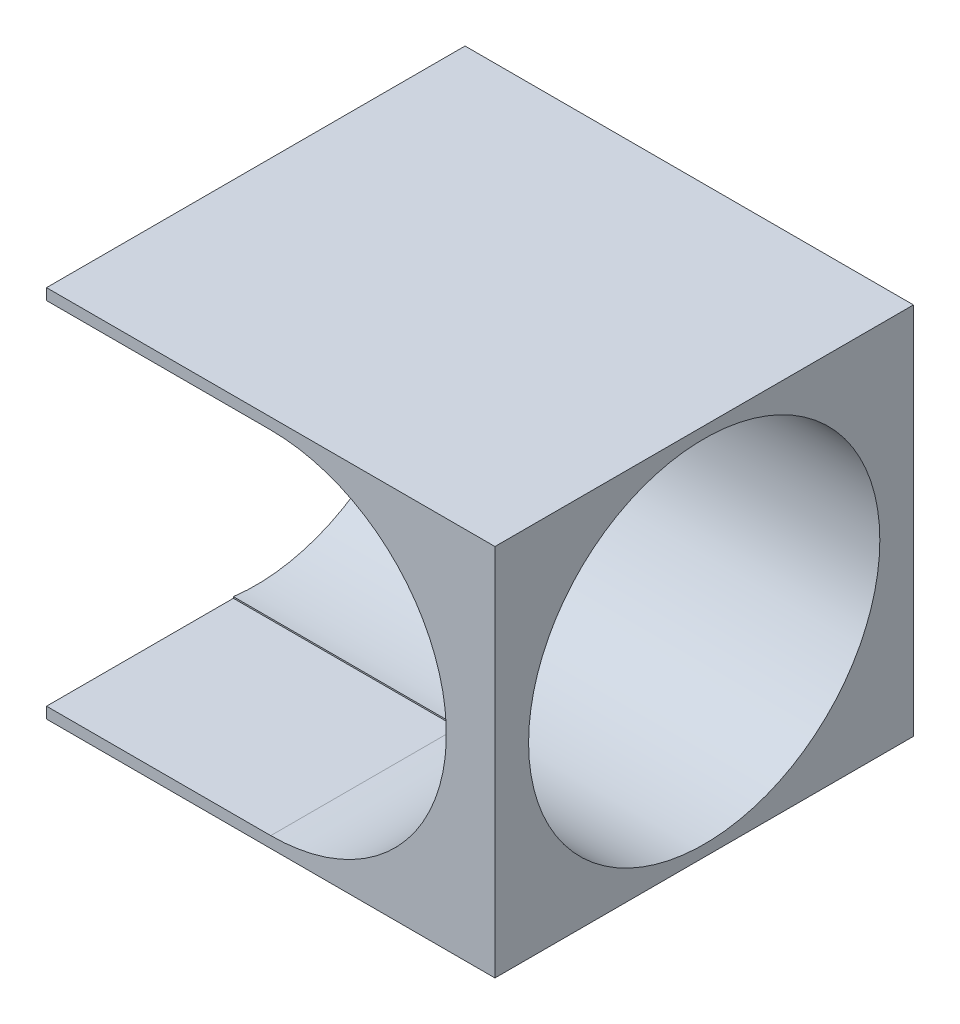
from build123d import *

# Parameters (mm, degrees)
SKETCH1_W           = 30
SKETCH1_H           = 28
BOSS_EXTRUDE1_DEPTH = 25
SKETCH2_R           = 11.75
CUT_EXTRUDE1_DEPTH  = 42.484937025
CUT_EXTRUDE2_DEPTH  = 12.5


with BuildPart() as part:
    # Sketch1 → Boss-Extrude1 (new body)
    with BuildSketch(Plane(origin=(0, 0, 0), x_dir=(1, 0, 0), z_dir=(0, 1, 0))):
        Rectangle(SKETCH1_W, SKETCH1_H)
    extrude(amount=BOSS_EXTRUDE1_DEPTH)

    # Sketch2 → Cut-Extrude1 (cut, through all)
    with BuildSketch(Plane.ZY.offset(15)):
        with Locations((0, 12.5)):
            Circle(SKETCH2_R)
    extrude(amount=-CUT_EXTRUDE1_DEPTH, mode=Mode.SUBTRACT)

    # Sketch3 → Cut-Extrude2 (cut)
    with BuildSketch(Plane.XY.offset(14)):
        with BuildLine():
            Line((0, 24.25), (-15, 24.25))
            Line((-15, 24.25), (-15, 0.75))
            Line((-15, 0.75), (0, 0.75))
            ThreePointArc((0, 0.75), (11.75, 12.5), (0, 24.25))
        make_face()
    extrude(amount=-CUT_EXTRUDE2_DEPTH, mode=Mode.SUBTRACT)


solid = part.part
